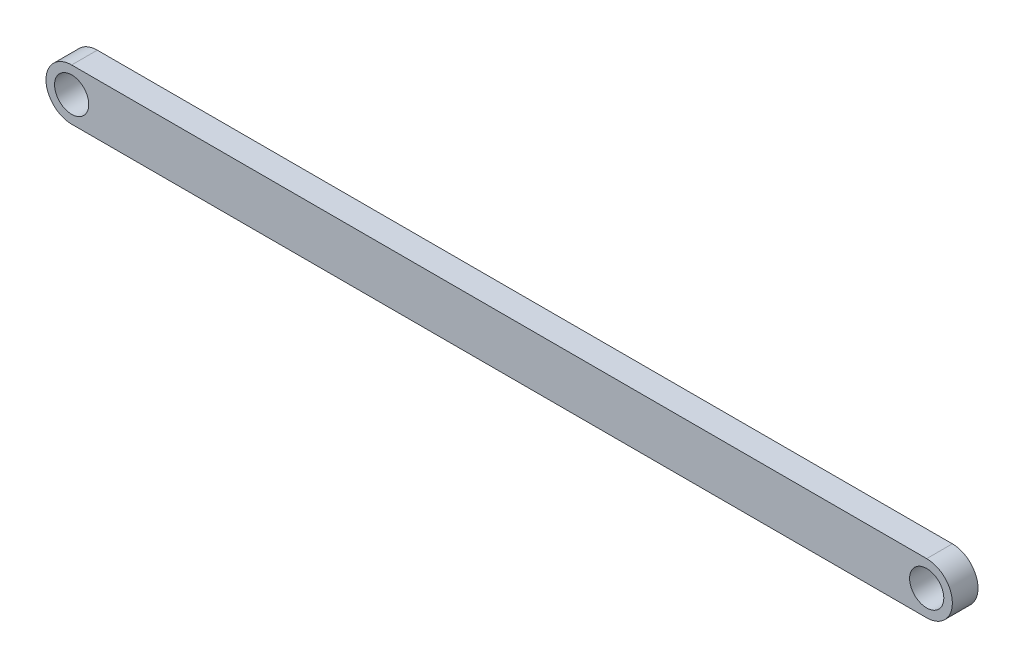
from build123d import *

# Parameters (mm, degrees)
SKETCH1_R      = 10
EXTRUDE1_DEPTH = 15


with BuildPart() as part:
    # Sketch1 → Extrude1 (new body)
    with BuildSketch(Plane.XY):
        with BuildLine():
            Line((-500, 15), (0, 15))
            ThreePointArc((0, 15), (15, 0), (0, -15))
            Line((0, -15), (-500, -15))
            ThreePointArc((-500, -15), (-515, 0), (-500, 15))
        make_face()
        with Locations((-500, 0)):
            Circle(SKETCH1_R, mode=Mode.SUBTRACT)
        Circle(SKETCH1_R, mode=Mode.SUBTRACT)
    extrude(amount=EXTRUDE1_DEPTH)


solid = part.part
